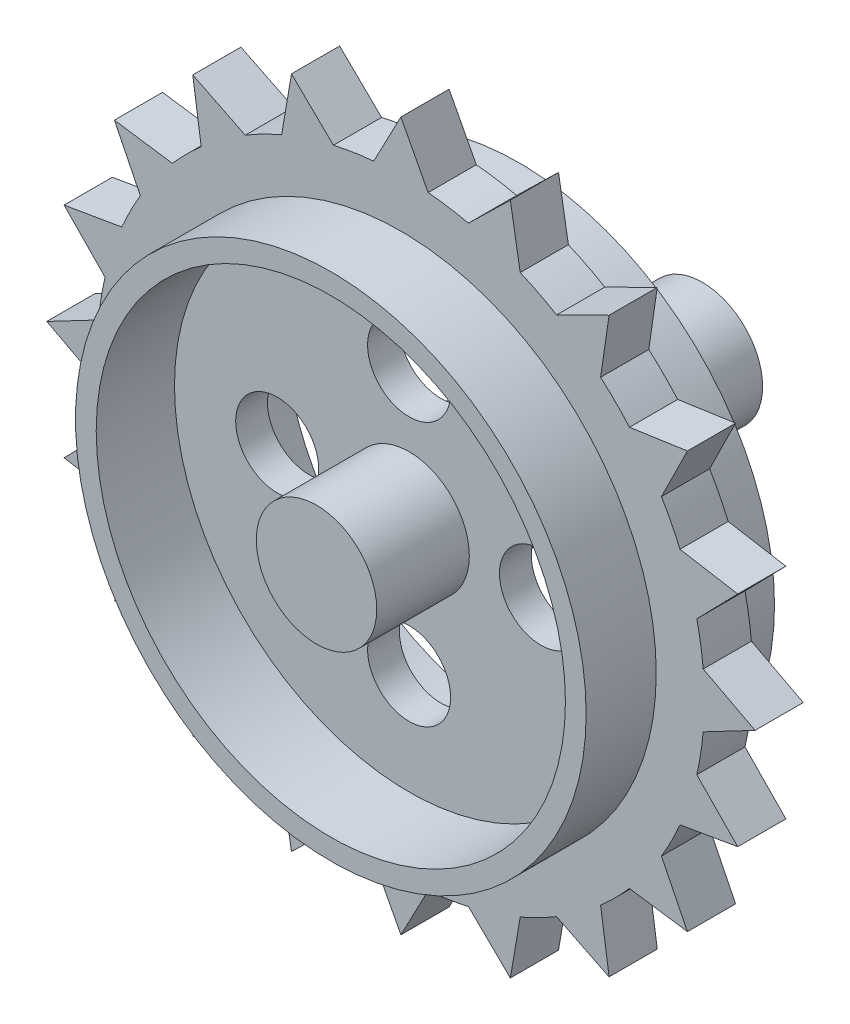
from build123d import *

# Parameters (mm, degrees)
CUT_EXTRUDE2_DEPTH  = 17.78
SKETCH4_R           = 2.189434211
CUT_EXTRUDE3_DEPTH  = 1.6764
BOSS_EXTRUDE1_DEPTH = 2.54


with BuildPart() as part:
    # Sketch1 → Revolve1 (revolve)
    with BuildSketch(Plane(origin=(0, 0, 0), x_dir=(0, 0, -1), z_dir=(1, 0, 0)), mode=Mode.PRIVATE) as revolve1_sk:
        Polygon((4.9657, 13.462), (1.27, 13.462), (1.27, 16.002), (-1.27, 16.002), (-1.27, 13.462), (-4.9657, 13.462), (-4.9657, 12.3698), (-0.8382, 12.3698), (-0.8382, 3.175), (-5.719832453, 3.175), (-5.719832453, 0), (0, 0), (14.625567547, 0), (14.625567547, 3.175), (0.8382, 3.175), (0.8382, 12.3698), (4.9657, 12.3698), align=None)
    revolve(revolve1_sk.sketch.rotate(Axis((0, 0, 0), (0, 0, -1)), 90), axis=Axis((0, 0, 0), (0, 0, -1)))

    # Sketch3 → Cut-Extrude2 (cut)
    with BuildSketch(Plane(origin=(0, 0, -14.625567547), x_dir=(-1, 0, 0), z_dir=(0, 0, -1))):
        Polygon((1.539793168, 0), (0.769896584, 1.3335), (-0.769896584, 1.3335), (-1.539793168, 0), (-0.769896584, -1.3335), (0.769896584, -1.3335), align=None)
    extrude(amount=-CUT_EXTRUDE2_DEPTH, mode=Mode.SUBTRACT)

    # Sketch4 → Cut-Extrude3 (cut)
    with BuildSketch(Plane(origin=(0, 0, -0.8382), x_dir=(-1, 0, 0), z_dir=(0, 0, -1))):
        with Locations((0, 6.954565789)):
            Circle(SKETCH4_R)
        with Locations((6.954565789, 0)):
            Circle(SKETCH4_R)
        with Locations((0, -6.954565789)):
            Circle(SKETCH4_R)
        with Locations((-6.954565789, 0)):
            Circle(SKETCH4_R)
    extrude(amount=-CUT_EXTRUDE3_DEPTH, mode=Mode.SUBTRACT)

    # Sketch5 → Boss-Extrude1 (add)
    with BuildSketch(Plane.XY.offset(1.27)):
        with BuildLine():
            ThreePointArc((-13.73725383, 8.206817971), (-12.945889944, 9.405739607), (-12.050192599, 10.528858548))
            Line((-12.050192599, 10.528858548), (-15.10552331, 10.974805092))
            Line((-15.10552331, 10.974805092), (-13.73725383, 8.206817971))
        make_face()
        with BuildLine():
            ThreePointArc((-10.528858548, 12.050192599), (-9.405739607, 12.945889944), (-8.206817971, 13.73725383))
            Line((-8.206817971, 13.73725383), (-10.974805092, 15.10552331))
            Line((-10.974805092, 15.10552331), (-10.528858548, 12.050192599))
        make_face()
        with BuildLine():
            ThreePointArc((-6.289825233, 14.714010417), (-4.944889944, 15.218806374), (-3.56010282, 15.600950994))
            Line((-3.56010282, 15.600950994), (-5.769796486, 17.757607659))
            Line((-5.769796486, 17.757607659), (-6.289825233, 14.714010417))
        make_face()
        with BuildLine():
            ThreePointArc((-1.4351, 15.937518376), (0, 16.002), (1.4351, 15.937518376))
            Line((1.4351, 15.937518376), (0, 18.671453646))
            Line((0, 18.671453646), (-1.4351, 15.937518376))
        make_face()
        with BuildLine():
            ThreePointArc((3.56010282, 15.600950994), (4.944889944, 15.218806374), (6.289825233, 14.714010417))
            Line((6.289825233, 14.714010417), (5.769796486, 17.757607659))
            Line((5.769796486, 17.757607659), (3.56010282, 15.600950994))
        make_face()
        with BuildLine():
            ThreePointArc((8.206817971, 13.73725383), (9.405739607, 12.945889944), (10.528858548, 12.050192599))
            Line((10.528858548, 12.050192599), (10.974805092, 15.10552331))
            Line((10.974805092, 15.10552331), (8.206817971, 13.73725383))
        make_face()
        with BuildLine():
            ThreePointArc((12.050192599, 10.528858548), (12.945889944, 9.405739607), (13.73725383, 8.206817971))
            Line((13.73725383, 8.206817971), (15.10552331, 10.974805092))
            Line((15.10552331, 10.974805092), (12.050192599, 10.528858548))
        make_face()
        with BuildLine():
            ThreePointArc((14.714010417, 6.289825233), (15.218806374, 4.944889944), (15.600950994, 3.56010282))
            Line((15.600950994, 3.56010282), (17.757607659, 5.769796486))
            Line((17.757607659, 5.769796486), (14.714010417, 6.289825233))
        make_face()
        with BuildLine():
            Line((18.671453646, 0), (16.002, 0))
            ThreePointArc((16.002, 0), (15.985871466, -0.718273954), (15.937518376, -1.4351))
            Line((15.937518376, -1.4351), (18.671453646, 0))
        make_face()
        with BuildLine():
            ThreePointArc((15.937518376, 1.4351), (15.985871466, 0.718273954), (16.002, 0))
            Line((16.002, 0), (18.671453646, 0))
            Line((18.671453646, 0), (15.937518376, 1.4351))
        make_face()
        with BuildLine():
            Line((17.757607659, -5.769796486), (15.600950994, -3.56010282))
            ThreePointArc((15.600950994, -3.56010282), (15.218806374, -4.944889944), (14.714010417, -6.289825233))
            Line((14.714010417, -6.289825233), (17.757607659, -5.769796486))
        make_face()
        with BuildLine():
            Line((15.10552331, -10.974805092), (13.73725383, -8.206817971))
            ThreePointArc((13.73725383, -8.206817971), (12.945889944, -9.405739607), (12.050192599, -10.528858548))
            Line((12.050192599, -10.528858548), (15.10552331, -10.974805092))
        make_face()
        with BuildLine():
            Line((10.974805092, -15.10552331), (10.528858548, -12.050192599))
            ThreePointArc((10.528858548, -12.050192599), (9.405739607, -12.945889944), (8.206817971, -13.73725383))
            Line((8.206817971, -13.73725383), (10.974805092, -15.10552331))
        make_face()
        with BuildLine():
            Line((5.769796486, -17.757607659), (6.289825233, -14.714010417))
            ThreePointArc((6.289825233, -14.714010417), (4.944889944, -15.218806374), (3.56010282, -15.600950994))
            Line((3.56010282, -15.600950994), (5.769796486, -17.757607659))
        make_face()
        with BuildLine():
            Line((0, -18.671453646), (1.4351, -15.937518376))
            ThreePointArc((1.4351, -15.937518376), (0, -16.002), (-1.4351, -15.937518376))
            Line((-1.4351, -15.937518376), (0, -18.671453646))
        make_face()
        with BuildLine():
            Line((-5.769796486, -17.757607659), (-3.56010282, -15.600950994))
            ThreePointArc((-3.56010282, -15.600950994), (-4.944889944, -15.218806374), (-6.289825233, -14.714010417))
            Line((-6.289825233, -14.714010417), (-5.769796486, -17.757607659))
        make_face()
        with BuildLine():
            Line((-10.974805092, -15.10552331), (-8.206817971, -13.73725383))
            ThreePointArc((-8.206817971, -13.73725383), (-9.405739607, -12.945889944), (-10.528858548, -12.050192599))
            Line((-10.528858548, -12.050192599), (-10.974805092, -15.10552331))
        make_face()
        with BuildLine():
            Line((-15.10552331, -10.974805092), (-12.050192599, -10.528858548))
            ThreePointArc((-12.050192599, -10.528858548), (-12.945889944, -9.405739607), (-13.73725383, -8.206817971))
            Line((-13.73725383, -8.206817971), (-15.10552331, -10.974805092))
        make_face()
        with BuildLine():
            Line((-17.757607659, -5.769796486), (-14.714010417, -6.289825233))
            ThreePointArc((-14.714010417, -6.289825233), (-15.218806374, -4.944889944), (-15.600950994, -3.56010282))
            Line((-15.600950994, -3.56010282), (-17.757607659, -5.769796486))
        make_face()
        with BuildLine():
            ThreePointArc((-15.937518376, -1.4351), (-16.002, 0), (-15.937518376, 1.4351))
            Line((-15.937518376, 1.4351), (-18.671453646, 0))
            Line((-18.671453646, 0), (-15.937518376, -1.4351))
        make_face()
        with BuildLine():
            ThreePointArc((-15.600950994, 3.56010282), (-15.218806374, 4.944889944), (-14.714010417, 6.289825233))
            Line((-14.714010417, 6.289825233), (-17.757607659, 5.769796486))
            Line((-17.757607659, 5.769796486), (-15.600950994, 3.56010282))
        make_face()
    extrude(amount=-BOSS_EXTRUDE1_DEPTH)


solid = part.part
